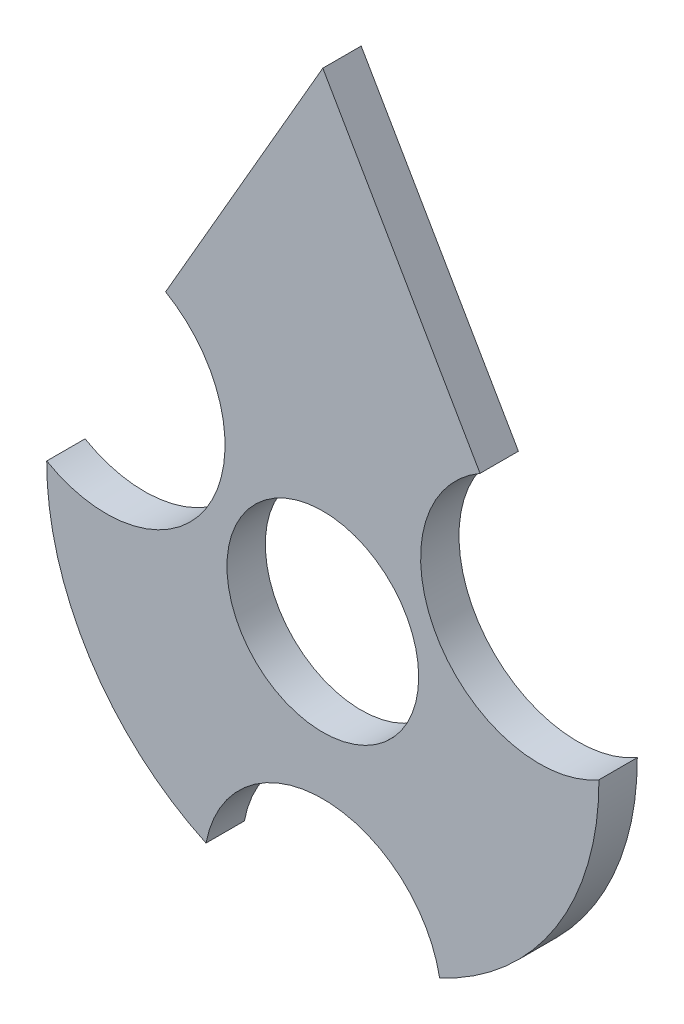
from build123d import *

# Parameters (mm, degrees)
SKETCH1_6_R         = 25
BOSS_EXTRUDE3_DEPTH = 5


with BuildPart() as part:
    # Sketch1<6> → Boss-Extrude3 (new, symmetric)
    with BuildSketch(Plane.XY):
        with BuildLine():
            Line((0, 125), (41, 53.98591689))
            ThreePointArc((41, 53.98591689), (29.653041557, 11.639425428), (71.999407886, 0.292000007))
            ThreePointArc((71.999407886, 0.292000007), (60.81182851, -38.5476525), (30.460070741, -65.23943662))
            ThreePointArc((30.460070741, -65.23943662), (0, -40), (-30.460070741, -65.23943662))
            ThreePointArc((-30.460070741, -65.23943662), (-60.81182851, -38.5476525), (-71.999407886, 0.292000007))
            ThreePointArc((-71.999407886, 0.292000007), (-29.653041557, 11.639425428), (-41, 53.98591689))
            Line((-41, 53.98591689), (0, 125))
        make_face()
        Circle(SKETCH1_6_R, mode=Mode.SUBTRACT)
    extrude(amount=BOSS_EXTRUDE3_DEPTH, both=True)


solid = part.part
